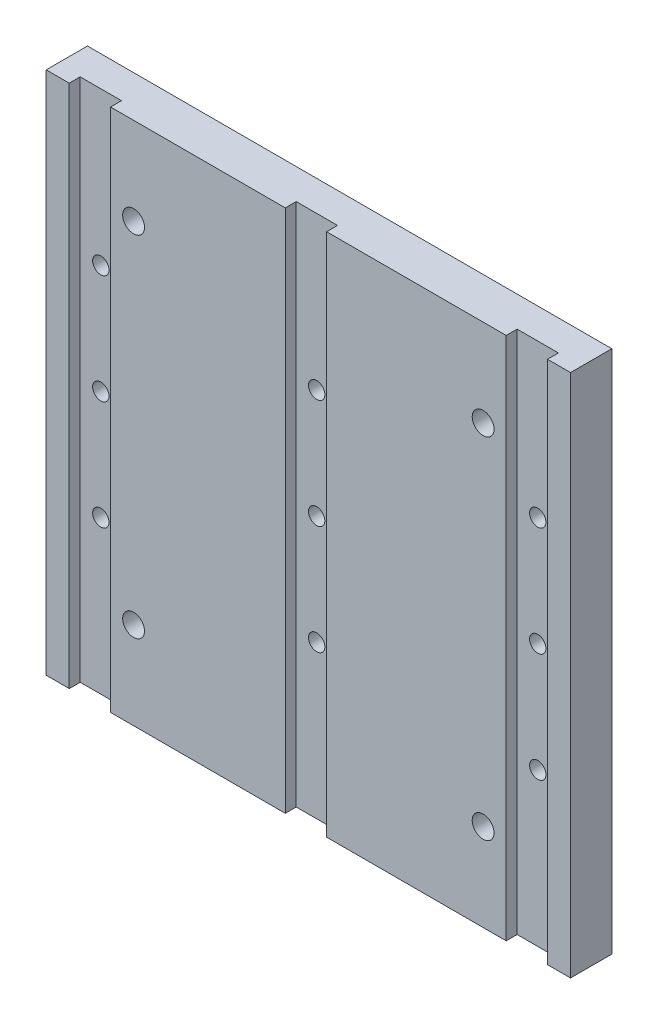
from build123d import *

# Parameters (mm, degrees)
SKETCH1_W           = 152.4
SKETCH1_H           = 152.4
SKETCH1_R           = 3.175
BOSS_EXTRUDE1_DEPTH = 12.0000014
SKETCH2_W           = 12.0000014
SKETCH2_H           = 152.4
CUT_EXTRUDE1_DEPTH  = 3.175
SKETCH3_R           = 2.38125
CUT_EXTRUDE2_DEPTH  = 109.123820917
SKETCH4_R           = 3.96875
CUT_EXTRUDE3_DEPTH  = 5.08
LPATTERN1_COUNT     = 2
LPATTERN1_PITCH     = 62.738
LPATTERN2_COUNT     = 2
LPATTERN2_PITCH     = 127


with BuildPart() as part:
    # Sketch1 → Boss-Extrude1 (new body)
    with BuildSketch(Plane.XY):
        Rectangle(SKETCH1_W, SKETCH1_H)
        with Locations((-50.8, 50.8)):
            Circle(SKETCH1_R, mode=Mode.SUBTRACT)
        with Locations((50.8, 50.8)):
            Circle(SKETCH1_R, mode=Mode.SUBTRACT)
        with Locations((50.8, -50.8)):
            Circle(SKETCH1_R, mode=Mode.SUBTRACT)
        with Locations((-50.8, -50.8)):
            Circle(SKETCH1_R, mode=Mode.SUBTRACT)
    extrude(amount=BOSS_EXTRUDE1_DEPTH)

    # Sketch2 → Cut-Extrude1 (cut)
    with BuildSketch(Plane.XY.offset(12.0000014)):
        with Locations((-63.5, 0)):
            Rectangle(SKETCH2_W, SKETCH2_H)
        with Locations((-0.6999986, 0)):
            Rectangle(SKETCH2_W, SKETCH2_H)
        with Locations((63.5, 0)):
            Rectangle(SKETCH2_W, SKETCH2_H)
    extrude(amount=-CUT_EXTRUDE1_DEPTH, mode=Mode.SUBTRACT)

    # Sketch3 → Cut-Extrude2 (cut, through all)
    with BuildSketch(Plane.XY.offset(8.8250014)):
        with Locations((-63.5, 0)):
            Circle(SKETCH3_R)
        with Locations((-63.5, 31.75)):
            Circle(SKETCH3_R)
        with Locations((-63.5, -31.75)):
            Circle(SKETCH3_R)
    cut_extrude2 = extrude(amount=-CUT_EXTRUDE2_DEPTH, mode=Mode.SUBTRACT)

    # Sketch4 → Cut-Extrude3 (cut)
    with BuildSketch(Plane(origin=(0, 0, 0), x_dir=(-1, 0, 0), z_dir=(0, 0, -1))):
        with Locations((63.5, 31.75)):
            Circle(SKETCH4_R)
        with Locations((63.5, 0)):
            Circle(SKETCH4_R)
        with Locations((63.5, -31.75)):
            Circle(SKETCH4_R)
    cut_extrude3 = extrude(amount=-CUT_EXTRUDE3_DEPTH, mode=Mode.SUBTRACT)

    # LPattern1: Cut-Extrude2, Cut-Extrude3 ×2
    with Locations(*[(i * LPATTERN1_PITCH, 0, 0) for i in range(1, LPATTERN1_COUNT)]):
        add(cut_extrude2, mode=Mode.SUBTRACT)
        add(cut_extrude3, mode=Mode.SUBTRACT)

    # LPattern2: Cut-Extrude2, Cut-Extrude3 ×2
    with Locations(*[(i * LPATTERN2_PITCH, 0, 0) for i in range(1, LPATTERN2_COUNT)]):
        add(cut_extrude2, mode=Mode.SUBTRACT)
        add(cut_extrude3, mode=Mode.SUBTRACT)


solid = part.part
